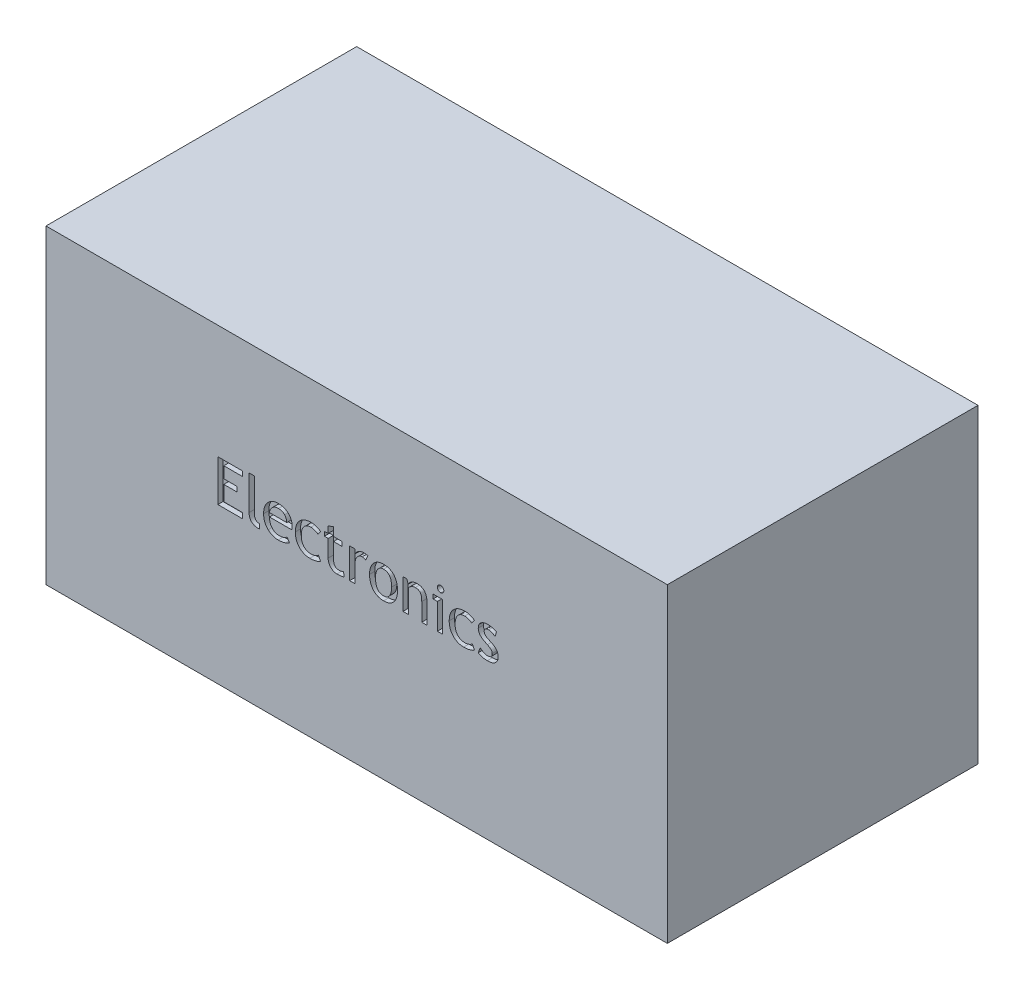
from build123d import *

# Parameters (mm, degrees)
SKETCH1_W           = 1524
SKETCH1_H           = 762
BOSS_EXTRUDE1_DEPTH = 762
CUT_EXTRUDE1_DEPTH  = 12.7


with BuildPart() as part:
    # Sketch1 → Boss-Extrude1 (new body)
    with BuildSketch(Plane(origin=(0, 0, 0), x_dir=(1, 0, 0), z_dir=(0, 1, 0))):
        Rectangle(SKETCH1_W, SKETCH1_H)
    extrude(amount=BOSS_EXTRUDE1_DEPTH)

    # Sketch2 → Cut-Extrude1 (cut)
    # profile 1 of 12: a face of its own
    with BuildSketch(Plane.XY.offset(381)):
        Polygon((-325.911688312, 470.724675325), (-325.911688312, 443.015584416), (-292.924675325, 443.015584416), (-292.924675325, 431.14025974), (-325.911688312, 431.14025974), (-325.911688312, 394.194805195), (-279.72987013, 394.194805195), (-279.72987013, 381), (-340.425974026, 381), (-340.425974026, 482.6), (-279.72987013, 482.6), (-279.72987013, 470.724675325), align=None)
    # profile 2 of 12: a face of its own
    with BuildSketch(Plane.XY.offset(381)):
        with BuildLine():
            Line((-263.896103896, 402.23538961), (-263.896103896, 486.558441558))
            Line((-263.896103896, 486.558441558), (-250.701298701, 486.558441558))
            Line((-250.701298701, 486.558441558), (-250.701298701, 404.48262987))
            add(Edge.make_bspline(
                [(-250.701298701, 404.48262987), (-250.666210351, 403.530308684), (-250.599014993, 401.706581956), (-249.967566383, 399.135515997), (-248.955585387, 396.860193421), (-247.496621835, 394.955404889), (-245.708733534, 393.429096108), (-243.63045224, 392.339333551), (-241.30849941, 391.653364424), (-239.669301946, 391.588972343), (-238.825974026, 391.555844156)],
                knots=[0, 0, 0, 0, 1.153096326, 2.208217795, 3.189003511, 4.152427551, 5.092536401, 6.017113196, 6.979852129, 8, 8, 8, 8], degree=3))
            Line((-238.825974026, 391.555844156), (-238.825974026, 379.680519481))
            add(Edge.make_bspline(
                [(-238.825974026, 379.680519481), (-239.83689173, 379.693374265), (-241.800683125, 379.718345748), (-244.644801944, 379.995557449), (-247.300732108, 380.417689091), (-249.76037151, 381.029109515), (-252.021542975, 381.839649736), (-254.090814403, 382.804079175), (-255.978076645, 383.942349325), (-257.640441598, 385.288709894), (-259.129480681, 386.789001581), (-260.418786424, 388.468387403), (-261.484866378, 390.341948311), (-262.385061446, 392.375548529), (-263.054526871, 394.600909337), (-263.549773334, 396.994088826), (-263.835173441, 399.562081704), (-263.875412223, 401.327547824), (-263.896103896, 402.23538961)],
                knots=[0, 0, 0, 0, 1.254804711, 2.437562112, 3.544378597, 4.591567393, 5.579398935, 6.522239218, 7.422250788, 8.308443737, 9.171282686, 10.041683172, 10.928615266, 11.841798046, 12.797257397, 13.808040261, 14.872845747, 16, 16, 16, 16], degree=3))
        make_face()
    # profile 3 of 12: a face of its own
    with BuildSketch(Plane.XY.offset(381)):
        with BuildLine():
            Line((-159.389123377, 417.945454545), (-213.755844156, 417.945454545))
            add(Edge.make_bspline(
                [(-213.755844156, 417.945454545), (-213.729563533, 416.82454726), (-213.678496864, 414.646478532), (-213.356702353, 411.479001529), (-212.781403168, 408.518712387), (-211.969844598, 405.762197663), (-210.968406357, 403.181343299), (-209.709015553, 400.809226442), (-208.217516989, 398.631626912), (-207.04362346, 397.350009988), (-206.457467532, 396.710064935)],
                knots=[0, 0, 0, 0, 1.167775368, 2.269139511, 3.312377417, 4.304673693, 5.259241788, 6.191231847, 7.096834467, 8, 8, 8, 8], degree=3))
            add(Edge.make_bspline(
                [(-206.457467532, 396.710064935), (-205.913177858, 396.186802308), (-204.835999826, 395.151237914), (-203.012904675, 393.864701835), (-201.113695138, 392.729141989), (-199.078637201, 391.8345228), (-196.947475311, 391.090879069), (-194.68743036, 390.61875108), (-192.323939021, 390.289633601), (-190.707381258, 390.254376325), (-189.881493506, 390.236363636)],
                knots=[0, 0, 0, 0, 0.989843858, 1.958953311, 2.921404456, 3.890597899, 4.872059572, 5.879024385, 6.91640879, 8, 8, 8, 8], degree=3))
            add(Edge.make_bspline(
                [(-189.881493506, 390.236363636), (-188.939088371, 390.255222554), (-187.090266595, 390.292220207), (-184.373767666, 390.61137564), (-181.772461164, 391.120404144), (-179.287705734, 391.843287129), (-176.925885963, 392.772695244), (-174.690192048, 393.912926904), (-172.567185904, 395.255972264), (-171.261837702, 396.305446655), (-170.604707792, 396.833766234)],
                knots=[0, 0, 0, 0, 1.086166282, 2.13085413, 3.148605832, 4.138974104, 5.110011886, 6.070258581, 7.028542114, 8, 8, 8, 8], degree=3))
            Line((-170.604707792, 396.833766234), (-164.935064935, 387.597402597))
            add(Edge.make_bspline(
                [(-164.935064935, 387.597402597), (-165.51299015, 387.104973695), (-166.744427714, 386.055710863), (-168.997029044, 384.776127521), (-171.612508389, 383.521573833), (-173.544601062, 382.855938078), (-174.563149351, 382.505032468)],
                knots=[0, 0, 0, 0, 0.829008863, 1.766444218, 2.822528312, 4, 4, 4, 4], degree=3))
            add(Edge.make_bspline(
                [(-174.563149351, 382.505032468), (-175.944259997, 382.066132269), (-178.755996571, 381.172596517), (-183.186227714, 380.312109864), (-187.8415324, 379.791444303), (-191.02085828, 379.718012321), (-192.644155844, 379.680519481)],
                knots=[0, 0, 0, 0, 0.945414737, 1.92472428, 2.940407449, 4, 4, 4, 4], degree=3))
            add(Edge.make_bspline(
                [(-192.644155844, 379.680519481), (-193.820788003, 379.706054434), (-196.141856013, 379.756425626), (-199.553176271, 380.221153041), (-202.82450223, 380.983974075), (-205.957101901, 382.044543486), (-208.962917263, 383.380972404), (-211.821815718, 385.05118356), (-214.557335946, 387.003717275), (-216.230423607, 388.52160728), (-217.075162338, 389.287987013)],
                knots=[0, 0, 0, 0, 1.048227686, 2.067772609, 3.061680434, 4.037860413, 5.011115386, 5.988102045, 6.984196606, 8, 8, 8, 8], degree=3))
            add(Edge.make_bspline(
                [(-217.075162338, 389.287987013), (-217.968430744, 390.190457343), (-219.745230977, 391.985561122), (-222.037332292, 394.995168977), (-223.968769226, 398.234786481), (-225.533992726, 401.704630616), (-226.787857013, 405.387321485), (-227.629459192, 409.311279577), (-228.193561191, 413.448299749), (-228.24421968, 416.28725252), (-228.27012987, 417.739285714)],
                knots=[0, 0, 0, 0, 0.967481273, 1.924417048, 2.876158889, 3.837660968, 4.822011602, 5.836599495, 6.893490101, 8, 8, 8, 8], degree=3))
            add(Edge.make_bspline(
                [(-228.27012987, 417.739285714), (-228.234291566, 419.245928951), (-228.164016842, 422.200280172), (-227.619943968, 426.513364676), (-226.736717392, 430.600184853), (-225.503452411, 434.461127487), (-223.884246308, 438.086374078), (-221.919419806, 441.481511191), (-219.598756976, 444.659039826), (-217.784802739, 446.553573596), (-216.868993506, 447.510064935)],
                knots=[0, 0, 0, 0, 1.103286409, 2.163415646, 3.178379871, 4.162134233, 5.126549343, 6.08055717, 7.030932849, 8, 8, 8, 8], degree=3))
            add(Edge.make_bspline(
                [(-216.868993506, 447.510064935), (-216.009949678, 448.309360318), (-214.320354861, 449.881439986), (-211.584240154, 451.935485589), (-208.715565456, 453.650878626), (-205.748527744, 455.087309942), (-202.648978224, 456.182101992), (-199.439536482, 456.973014767), (-196.106966599, 457.426046164), (-193.848127659, 457.495003638), (-192.706006494, 457.52987013)],
                knots=[0, 0, 0, 0, 1.047961233, 2.061163597, 3.050032296, 4.030553054, 5.001664552, 5.981646773, 6.979473968, 8, 8, 8, 8], degree=3))
            add(Edge.make_bspline(
                [(-192.706006494, 457.52987013), (-191.392375274, 457.501414491), (-188.827153046, 457.445847116), (-185.087514583, 457.035248135), (-181.563705957, 456.332419956), (-178.255789363, 455.367852662), (-175.159451507, 454.134813017), (-172.295552803, 452.592230041), (-169.63439462, 450.787309474), (-168.053340608, 449.357250813), (-167.264772727, 448.643993506)],
                knots=[0, 0, 0, 0, 1.140665541, 2.227459699, 3.262123076, 4.257359294, 5.215990926, 6.15052194, 7.077552707, 8, 8, 8, 8], degree=3))
            add(Edge.make_bspline(
                [(-167.264772727, 448.643993506), (-166.554160668, 447.916362412), (-165.143826231, 446.472250711), (-163.324954783, 444.053003131), (-161.765022596, 441.467649209), (-160.506517841, 438.6908205), (-159.540456735, 435.743324924), (-158.834225381, 432.631778583), (-158.422386116, 429.34390623), (-158.366297266, 427.093632774), (-158.337662338, 425.944805195)],
                knots=[0, 0, 0, 0, 0.971813225, 1.928734025, 2.886782605, 3.854408881, 4.837446585, 5.848277975, 6.901485685, 8, 8, 8, 8], degree=3))
            add(Edge.make_bspline(
                [(-158.337662338, 425.944805195), (-158.34701926, 425.236337988), (-158.365411662, 423.843741905), (-158.585147901, 421.799403196), (-158.902199674, 419.833512021), (-159.228370192, 418.568778592), (-159.389123377, 417.945454545)],
                knots=[0, 0, 0, 0, 1.050108016, 2.064141145, 3.045911693, 4, 4, 4, 4], degree=3))
        make_face()
        with BuildLine():
            add(Edge.make_bspline(
                [(-191.963798701, 446.974025974), (-192.707158465, 446.962795571), (-194.165491842, 446.940763612), (-196.295067788, 446.631638637), (-198.333877699, 446.186638661), (-200.281416896, 445.542661698), (-202.14636601, 444.714381385), (-203.922509249, 443.701636693), (-205.608051166, 442.505918751), (-206.625045602, 441.570075896), (-207.137824675, 441.098214286)],
                knots=[0, 0, 0, 0, 1.06759705, 2.094426531, 3.086601989, 4.06436251, 5.037270591, 6.015031111, 6.999158234, 8, 8, 8, 8], degree=3))
            add(Edge.make_bspline(
                [(-207.137824675, 441.098214286), (-207.608106508, 440.626007397), (-208.537723637, 439.692584965), (-209.750553205, 438.147736958), (-210.839094899, 436.538754274), (-211.737982189, 434.826149344), (-212.489732543, 433.03232381), (-213.082574591, 431.162959906), (-213.529560203, 429.204909909), (-213.679516005, 427.864230033), (-213.755844156, 427.181818182)],
                knots=[0, 0, 0, 0, 1.014452497, 2.005292046, 2.986739539, 3.97025095, 4.946323062, 5.946247264, 6.954630981, 8, 8, 8, 8], degree=3))
            Line((-213.755844156, 427.181818182), (-171.532467532, 427.181818182))
            add(Edge.make_bspline(
                [(-171.532467532, 427.181818182), (-171.547367821, 427.856148311), (-171.576664224, 429.181991607), (-171.834682558, 431.119086204), (-172.223832804, 432.97647376), (-172.774665877, 434.747834241), (-173.510377196, 436.435307019), (-174.389934322, 438.043769365), (-175.449481043, 439.557867847), (-176.258902734, 440.48667311), (-176.666071429, 440.953896104)],
                knots=[0, 0, 0, 0, 1.074154994, 2.111964356, 3.108624356, 4.095792429, 5.062147245, 6.037581814, 7.012831928, 8, 8, 8, 8], degree=3))
            add(Edge.make_bspline(
                [(-176.666071429, 440.953896104), (-177.14481781, 441.431113596), (-178.098930327, 442.382179127), (-179.693157144, 443.630918939), (-181.435788648, 444.652896996), (-183.289657728, 445.514731808), (-185.276947179, 446.166708908), (-187.394587317, 446.649052565), (-189.641563484, 446.905410304), (-191.179787333, 446.950860592), (-191.963798701, 446.974025974)],
                knots=[0, 0, 0, 0, 0.95760174, 1.908442216, 2.860628821, 3.81510446, 4.800779991, 5.819262726, 6.888508446, 8, 8, 8, 8], degree=3))
        make_face(mode=Mode.SUBTRACT)
    # profile 4 of 12: a face of its own
    with BuildSketch(Plane.XY.offset(381)):
        with BuildLine():
            Line((-88.405194805, 449.612987013), (-94.981980519, 440.376623377))
            add(Edge.make_bspline(
                [(-94.981980519, 440.376623377), (-95.375501944, 440.782199051), (-96.226844885, 441.659620119), (-97.875531575, 442.764443361), (-99.877315327, 443.863035014), (-102.197765035, 444.887103451), (-104.693983291, 445.817655886), (-107.253374875, 446.460903689), (-109.782726096, 446.912428962), (-111.466703646, 446.95363278), (-112.300162338, 446.974025974)],
                knots=[0, 0, 0, 0, 0.714129473, 1.544945328, 2.499524529, 3.606123095, 4.754426172, 5.869211769, 6.945399259, 8, 8, 8, 8], degree=3))
            add(Edge.make_bspline(
                [(-112.300162338, 446.974025974), (-113.181300023, 446.951764297), (-114.91043263, 446.908078284), (-117.429869394, 446.521229758), (-119.813786368, 445.938297392), (-122.056386484, 445.077014017), (-124.152170766, 443.966970642), (-126.106115822, 442.612171724), (-127.922353188, 441.026150136), (-129.581674348, 439.199166577), (-131.058393795, 437.150398962), (-132.373008869, 434.935689491), (-133.459506144, 432.524145276), (-134.372075609, 429.940080827), (-135.068514685, 427.164836455), (-135.557014993, 424.213666668), (-135.845944214, 421.084984953), (-135.885949765, 418.942555432), (-135.906493506, 417.84237013)],
                knots=[0, 0, 0, 0, 0.999237626, 1.960890323, 2.885732248, 3.779273414, 4.679256432, 5.570446663, 6.471273863, 7.409692175, 8.364268318, 9.332537753, 10.32704794, 11.360420259, 12.438461241, 13.569168563, 14.751713886, 16, 16, 16, 16], degree=3))
            add(Edge.make_bspline(
                [(-135.906493506, 417.84237013), (-135.88855508, 416.748805206), (-135.853729809, 414.625782054), (-135.532491533, 411.547414842), (-135.052858426, 408.669254341), (-134.349119887, 405.991454052), (-133.447068153, 403.509137919), (-132.33381036, 401.223508635), (-130.99892235, 399.152247383), (-129.502232129, 397.262590002), (-127.7920456, 395.610083203), (-125.942049563, 394.156481475), (-123.911799287, 392.953760005), (-121.734062387, 391.961136989), (-119.39958309, 391.176308391), (-116.91201092, 390.624937115), (-114.275039943, 390.286478577), (-112.466150829, 390.253366003), (-111.537337662, 390.236363636)],
                knots=[0, 0, 0, 0, 1.252959939, 2.432469166, 3.543482404, 4.594231037, 5.600926928, 6.566094148, 7.501227139, 8.420098036, 9.322413799, 10.220456753, 11.110624572, 12.019960222, 12.958966101, 13.927758104, 14.935962662, 16, 16, 16, 16], degree=3))
            add(Edge.make_bspline(
                [(-111.537337662, 390.236363636), (-110.794089415, 390.256380593), (-109.301261361, 390.296585026), (-107.065368441, 390.61954166), (-104.825184465, 391.140177404), (-102.581819249, 391.858964953), (-100.33917117, 392.801410233), (-98.090071221, 393.943508858), (-95.82061897, 395.271475774), (-94.362867792, 396.306976229), (-93.621266234, 396.833766234)],
                knots=[0, 0, 0, 0, 0.918512099, 1.844848789, 2.786639656, 3.75923298, 4.753223091, 5.790457131, 6.875939558, 8, 8, 8, 8], degree=3))
            Line((-93.621266234, 396.833766234), (-88.405194805, 386.277922078))
            add(Edge.make_bspline(
                [(-88.405194805, 386.277922078), (-89.317640446, 385.746535824), (-91.158032482, 384.674736053), (-94.103910872, 383.34542014), (-97.19860079, 382.211703783), (-100.450890881, 381.281916999), (-103.861420597, 380.562382871), (-107.435837128, 380.052682398), (-111.167408949, 379.737255807), (-113.708350743, 379.699650158), (-115.000974026, 379.680519481)],
                knots=[0, 0, 0, 0, 0.912713853, 1.840933016, 2.79052362, 3.761251731, 4.763775478, 5.802708547, 6.882197894, 8, 8, 8, 8], degree=3))
            add(Edge.make_bspline(
                [(-115.000974026, 379.680519481), (-116.253230335, 379.712785521), (-118.711947662, 379.776137626), (-122.317203346, 380.257585569), (-125.759201221, 381.057067261), (-129.030105576, 382.201338303), (-132.146251757, 383.645414335), (-135.082756725, 385.434097149), (-137.863075026, 387.528607117), (-140.455934069, 389.931838858), (-142.791090042, 392.625601601), (-144.861504308, 395.547589513), (-146.56503251, 398.721383221), (-147.975550953, 402.113218237), (-149.093167454, 405.727789859), (-149.867736976, 409.574962347), (-150.321946064, 413.646216993), (-150.387248319, 416.432372976), (-150.420779221, 417.862987013)],
                knots=[0, 0, 0, 0, 1.025697672, 2.013885354, 2.973956964, 3.915895403, 4.847870077, 5.782561884, 6.72732302, 7.69541756, 8.673156467, 9.643164676, 10.623186641, 11.617578138, 12.648716234, 13.717577208, 14.828039025, 16, 16, 16, 16], degree=3))
            add(Edge.make_bspline(
                [(-150.420779221, 417.862987013), (-150.390133664, 419.321280238), (-150.330103636, 422.177856998), (-149.831054662, 426.346008829), (-149.000154131, 430.289157614), (-147.877600907, 434.027411412), (-146.386187394, 437.532053468), (-144.58302534, 440.829627469), (-142.426365878, 443.881925995), (-139.971737845, 446.711023626), (-137.240584395, 449.270827428), (-134.233490103, 451.484354292), (-130.984322578, 453.361075033), (-127.492277314, 454.872809526), (-123.768981603, 456.090491842), (-119.79914144, 456.911016205), (-115.592979946, 457.448339786), (-112.707378426, 457.502238919), (-111.228084416, 457.52987013)],
                knots=[0, 0, 0, 0, 1.110701233, 2.175696407, 3.192233128, 4.177621257, 5.144178712, 6.088488417, 7.035508184, 7.985562121, 8.937561489, 9.881014532, 10.823915415, 11.789806225, 12.774916153, 13.802781966, 14.873603491, 16, 16, 16, 16], degree=3))
            add(Edge.make_bspline(
                [(-111.228084416, 457.52987013), (-110.230105068, 457.493925532), (-108.175665891, 457.419930021), (-105.037169861, 456.932704207), (-101.789727288, 456.086643196), (-98.526017402, 454.974947963), (-95.418224156, 453.712259137), (-92.65451816, 452.41006897), (-90.326209226, 451.085169378), (-89.014548683, 450.07996947), (-88.405194805, 449.612987013)],
                knots=[0, 0, 0, 0, 0.977055502, 2.011365371, 3.101418391, 4.258843969, 5.384546701, 6.383661135, 7.249102703, 8, 8, 8, 8], degree=3))
        make_face()
    # profile 5 of 12: a face of its own
    with BuildSketch(Plane.XY.offset(381)):
        with BuildLine():
            Line((-69.932467532, 444.335064935), (-79.168831169, 444.335064935))
            Line((-79.168831169, 444.335064935), (-79.168831169, 454.890909091))
            Line((-79.168831169, 454.890909091), (-69.932467532, 454.890909091))
            Line((-69.932467532, 454.890909091), (-69.932467532, 470.807142857))
            Line((-69.932467532, 470.807142857), (-56.737662338, 476.002597403))
            Line((-56.737662338, 476.002597403), (-56.737662338, 454.890909091))
            Line((-56.737662338, 454.890909091), (-35.625974026, 454.890909091))
            Line((-35.625974026, 454.890909091), (-35.625974026, 444.335064935))
            Line((-35.625974026, 444.335064935), (-56.737662338, 444.335064935))
            Line((-56.737662338, 444.335064935), (-56.737662338, 407.492694805))
            add(Edge.make_bspline(
                [(-56.737662338, 407.492694805), (-56.734318765, 406.743183194), (-56.727837265, 405.290258195), (-56.549198843, 403.19967183), (-56.31715607, 401.276195739), (-55.963445831, 399.525872036), (-55.516455873, 397.937381673), (-54.967489143, 396.509421522), (-54.303857638, 395.255409564), (-53.533175301, 394.167688736), (-52.65253178, 393.225468378), (-51.657029555, 392.402928587), (-50.505689434, 391.759962375), (-49.2630559, 391.189851131), (-47.890880358, 390.761668061), (-46.399213227, 390.455979347), (-44.784611849, 390.268725989), (-43.667079553, 390.247393235), (-43.089285714, 390.236363636)],
                knots=[0, 0, 0, 0, 1.412375387, 2.737883543, 3.952723546, 5.06303916, 6.100522586, 7.060446298, 7.941412932, 8.768226801, 9.565694039, 10.366940763, 11.191315048, 12.043716813, 12.941012141, 13.893828134, 14.911053281, 16, 16, 16, 16], degree=3))
            add(Edge.make_bspline(
                [(-43.089285714, 390.236363636), (-42.214118322, 390.268657108), (-40.436536128, 390.334249474), (-37.755653367, 390.865429156), (-35.025997627, 391.675870268), (-33.253947257, 392.469525197), (-32.34788961, 392.875324675)],
                knots=[0, 0, 0, 0, 0.941382402, 1.912073746, 2.932433537, 4, 4, 4, 4], degree=3))
            Line((-32.34788961, 392.875324675), (-30.348051948, 381.680357143))
            add(Edge.make_bspline(
                [(-30.348051948, 381.680357143), (-31.767490865, 381.374985539), (-34.653378936, 380.754128765), (-39.128874717, 380.121627454), (-43.804417376, 379.749759925), (-46.992051352, 379.703875447), (-48.61461039, 379.680519481)],
                knots=[0, 0, 0, 0, 0.94587189, 1.923070004, 2.942807876, 4, 4, 4, 4], degree=3))
            add(Edge.make_bspline(
                [(-48.61461039, 379.680519481), (-49.351269665, 379.698707417), (-50.796943972, 379.73440076), (-52.913860468, 380.063783808), (-54.953480722, 380.542136697), (-56.893422774, 381.281542309), (-58.763865041, 382.187486393), (-60.542765599, 383.304581365), (-62.221736124, 384.63955705), (-63.792751193, 386.153675139), (-65.238081432, 387.816748017), (-66.491922743, 389.608192422), (-67.559088094, 391.506165466), (-68.420564085, 393.512455255), (-69.109959021, 395.621802983), (-69.576236004, 397.848205789), (-69.870824776, 400.172683972), (-69.911728517, 401.760304407), (-69.932467532, 402.56525974)],
                knots=[0, 0, 0, 0, 1.011657449, 1.985350936, 2.938256691, 3.885576537, 4.83171868, 5.790782512, 6.765757656, 7.774368669, 8.785452854, 9.788965921, 10.774179575, 11.772479321, 12.784974034, 13.818611436, 14.893992343, 16, 16, 16, 16], degree=3))
            Line((-69.932467532, 402.56525974), (-69.932467532, 444.335064935))
        make_face()
    # profile 6 of 12: a face of its own
    with BuildSketch(Plane.XY.offset(381)):
        with BuildLine():
            add(Edge.make_bspline(
                [(22.225, 443.984577922), (21.514116545, 444.436825565), (20.137724199, 445.3124546), (17.956438236, 446.272302654), (15.755123126, 446.864537515), (14.277236523, 446.937761003), (13.545292208, 446.974025974)],
                knots=[0, 0, 0, 0, 1.083912525, 2.09864063, 3.058324786, 4, 4, 4, 4], degree=3))
            add(Edge.make_bspline(
                [(13.545292208, 446.974025974), (12.966614768, 446.954702119), (11.821442196, 446.916461213), (10.137618745, 446.595839065), (8.511439485, 446.074458614), (6.939926953, 445.348094121), (5.417555712, 444.414795684), (3.982358769, 443.239099042), (2.568220726, 441.900797622), (1.250504938, 440.357628343), (0.00830969, 438.693052931), (-1.023746521, 436.884259357), (-1.960201608, 435.026728353), (-2.659264674, 433.058948912), (-3.254833846, 431.025433519), (-3.657438439, 428.898920512), (-3.913306874, 426.68642947), (-3.943241512, 425.18270756), (-3.958441558, 424.419155844)],
                knots=[0, 0, 0, 0, 0.879821936, 1.741121875, 2.597521335, 3.47235911, 4.368980926, 5.306256831, 6.289802627, 7.327487782, 8.389847235, 9.44425347, 10.491690238, 11.550235473, 12.6158827, 13.712920077, 14.838679022, 16, 16, 16, 16], degree=3))
            Line((-3.958441558, 424.419155844), (-3.958441558, 381))
            Line((-3.958441558, 381), (-17.153246753, 381))
            Line((-17.153246753, 381), (-17.153246753, 454.890909091))
            Line((-17.153246753, 454.890909091), (-3.958441558, 454.890909091))
            Line((-3.958441558, 454.890909091), (-3.958441558, 444.335064935))
            add(Edge.make_bspline(
                [(-3.958441558, 444.335064935), (-3.343630933, 445.381923602), (-2.151048013, 447.412574527), (-0.005179058, 450.118459497), (2.358825591, 452.41612363), (4.961990225, 454.295158581), (7.79247367, 455.749881333), (10.840898734, 456.785980772), (14.103356956, 457.418514239), (16.353176651, 457.492191567), (17.503733766, 457.52987013)],
                knots=[0, 0, 0, 0, 1.095181229, 2.124384928, 3.107413611, 4.063213658, 5.012363421, 5.969994755, 6.961855929, 8, 8, 8, 8], degree=3))
            add(Edge.make_bspline(
                [(17.503733766, 457.52987013), (18.156840317, 457.507485588), (19.602830428, 457.457925795), (21.96588738, 457.253763728), (24.710274945, 456.835075703), (26.664995086, 456.508518462), (27.709090909, 456.334090909)],
                knots=[0, 0, 0, 0, 0.762334318, 1.687822431, 2.764971572, 4, 4, 4, 4], degree=3))
            Line((27.709090909, 456.334090909), (22.225, 443.984577922))
        make_face()
    # profile 7 of 12: a face of its own
    with BuildSketch(Plane.XY.offset(381)):
        with BuildLine():
            add(Edge.make_bspline(
                [(31.667532468, 418.77012987), (31.690727939, 420.187391981), (31.736006841, 422.95396952), (32.221304031, 426.995537275), (32.90529859, 430.84202268), (33.983127513, 434.46075076), (35.28993536, 437.888998562), (36.925130748, 441.093227543), (38.862039809, 444.083766746), (41.057256841, 446.858523179), (43.49509486, 449.378189017), (46.173136684, 451.543666792), (49.01792383, 453.40678357), (52.061449422, 454.90706786), (55.287029345, 456.096286621), (58.695223132, 456.93560554), (62.295923532, 457.440563705), (64.755961081, 457.499632621), (66.01525974, 457.52987013)],
                knots=[0, 0, 0, 0, 1.167075045, 2.278197929, 3.349840171, 4.38193595, 5.384007613, 6.36905809, 7.339665984, 8.31503514, 9.280011473, 10.221801653, 11.146830462, 12.076146957, 13.011241213, 13.973905745, 14.962837872, 16, 16, 16, 16], degree=3))
            add(Edge.make_bspline(
                [(66.01525974, 457.52987013), (67.336079687, 457.497798045), (69.910972071, 457.435274636), (73.662299231, 456.960891109), (77.18117407, 456.151916807), (80.488716375, 455.058412233), (83.530900618, 453.560096875), (86.384382837, 451.82164842), (88.978107273, 449.703314558), (91.352992928, 447.298185044), (93.444456339, 444.583528082), (95.304280847, 441.639737038), (96.841633626, 438.431113641), (98.103941061, 434.977533183), (99.091557534, 431.279644283), (99.784242954, 427.327070803), (100.197694253, 423.129127907), (100.252426514, 420.24863092), (100.280519481, 418.77012987)],
                knots=[0, 0, 0, 0, 1.079863132, 2.105155485, 3.085271676, 4.028881107, 4.946240321, 5.852238611, 6.755304408, 7.677196192, 8.610170789, 9.551904321, 10.519520607, 11.513330615, 12.554742623, 13.644922898, 14.791186388, 16, 16, 16, 16], degree=3))
            add(Edge.make_bspline(
                [(100.280519481, 418.77012987), (100.254156128, 417.298352799), (100.202664531, 414.423750567), (99.762892619, 410.232930163), (99.050317815, 406.28050725), (98.040211278, 402.566773908), (96.738367725, 399.097432656), (95.177615109, 395.849956624), (93.280602906, 392.867059233), (91.124759044, 390.124888031), (88.714484714, 387.674707315), (86.092052895, 385.52580029), (83.262799692, 383.697839766), (80.19935423, 382.238450051), (76.951267379, 381.065190314), (73.480520319, 380.282971805), (69.817375362, 379.76718273), (67.302231023, 379.709853968), (66.01525974, 379.680519481)],
                knots=[0, 0, 0, 0, 1.20188332, 2.347459098, 3.437446682, 4.479189465, 5.486346161, 6.460407083, 7.416593509, 8.367774511, 9.304535764, 10.218052079, 11.132051152, 12.048408626, 12.984076073, 13.946715913, 14.949357453, 16, 16, 16, 16], degree=3))
            add(Edge.make_bspline(
                [(66.01525974, 379.680519481), (64.701064833, 379.710859119), (62.131681128, 379.770176174), (58.395044891, 380.270880019), (54.877620057, 381.0943029), (51.584686234, 382.24971518), (48.502291623, 383.734833084), (45.670098261, 385.596564217), (43.028804914, 387.738167395), (40.660206624, 390.23311183), (38.538170064, 392.990246542), (36.701413042, 396.003559939), (35.120053782, 399.226183081), (33.868517518, 402.702286789), (32.887942613, 406.394130876), (32.155586085, 410.313344181), (31.753235056, 414.466446149), (31.696561794, 417.312378821), (31.667532468, 418.77012987)],
                knots=[0, 0, 0, 0, 1.070809026, 2.093539738, 3.066333794, 4.010584142, 4.932489864, 5.847597811, 6.767066902, 7.698065835, 8.644771889, 9.597770613, 10.56977414, 11.565661655, 12.603739209, 13.680407079, 14.811852069, 16, 16, 16, 16], degree=3))
        make_face()
        with BuildLine():
            add(Edge.make_bspline(
                [(46.181818182, 418.790746753), (46.198748329, 417.635885363), (46.231534395, 415.399439311), (46.451694962, 412.156350204), (46.845986967, 409.142439487), (47.367170728, 406.347858995), (48.075835121, 403.780137763), (48.908554665, 401.42016382), (49.916604989, 399.279775404), (51.101155484, 397.383383789), (52.397754625, 395.674030359), (53.904115321, 394.234933745), (55.529081362, 392.977883018), (57.336764745, 391.985702307), (59.285331088, 391.190972914), (61.402033589, 390.652062894), (63.658687409, 390.279336942), (65.216457577, 390.250930204), (66.01525974, 390.236363636)],
                knots=[0, 0, 0, 0, 1.403165019, 2.717298277, 3.94664954, 5.094588496, 6.168180087, 7.179748012, 8.132138505, 9.035809774, 9.892631734, 10.731111953, 11.559427893, 12.381788447, 13.228378108, 14.109391495, 15.030523118, 16, 16, 16, 16], degree=3))
            add(Edge.make_bspline(
                [(66.01525974, 390.236363636), (66.765707552, 390.260814397), (68.233801626, 390.308647192), (70.374731635, 390.663194397), (72.393689989, 391.259695071), (74.279327339, 392.117933919), (76.052434765, 393.187625645), (77.665569159, 394.537464028), (79.185312419, 396.088155692), (80.556797966, 397.888257897), (81.792944747, 399.890344251), (82.867295542, 402.077853758), (83.742554094, 404.447132186), (84.493604754, 406.971937357), (85.064729265, 409.682058041), (85.470154143, 412.56817527), (85.721956765, 415.625019694), (85.751232336, 417.718171077), (85.766233766, 418.790746753)],
                knots=[0, 0, 0, 0, 0.923804163, 1.807229492, 2.663987905, 3.50862415, 4.351860268, 5.205688153, 6.09138034, 7.020633582, 7.985836002, 8.98497942, 10.016045611, 11.092475389, 12.226097157, 13.422869221, 14.679422898, 16, 16, 16, 16], degree=3))
            add(Edge.make_bspline(
                [(85.766233766, 418.790746753), (85.749672768, 419.9319029), (85.717713278, 422.134111215), (85.49335379, 425.335561033), (85.105153477, 428.309193752), (84.57709707, 431.074906021), (83.877386698, 433.610908418), (83.036830955, 435.931465735), (82.044890998, 438.035328424), (80.894861566, 439.925618623), (79.559927191, 441.583286108), (78.094106446, 443.048338996), (76.451005987, 444.268321899), (74.663578878, 445.268184532), (72.719520698, 446.032348355), (70.625067142, 446.589971754), (68.369395701, 446.922883576), (66.81358488, 446.956682769), (66.01525974, 446.974025974)],
                knots=[0, 0, 0, 0, 1.39983981, 2.701417224, 3.934263667, 5.076720164, 6.152536382, 7.15800922, 8.100736454, 9.001519505, 9.865205975, 10.705747633, 11.536979174, 12.367269681, 13.211060351, 14.092422279, 15.021174534, 16, 16, 16, 16], degree=3))
            add(Edge.make_bspline(
                [(66.01525974, 446.974025974), (65.278382311, 446.950193157), (63.837270054, 446.903583282), (61.734701646, 446.539806357), (59.735460204, 445.968935694), (57.854595568, 445.134980929), (56.079951635, 444.079511904), (54.447094024, 442.758142811), (52.914252719, 441.228482428), (51.51483576, 439.469387284), (50.257779964, 437.507715685), (49.163348984, 435.351604402), (48.242646875, 433.016136356), (47.472981399, 430.51601281), (46.90892192, 427.829180489), (46.470348884, 424.974274813), (46.228123796, 421.935585935), (46.197508484, 419.856351389), (46.181818182, 418.790746753)],
                knots=[0, 0, 0, 0, 0.914220699, 1.787942746, 2.641014476, 3.488995239, 4.334612677, 5.196595123, 6.089350075, 7.017945201, 7.981047695, 8.976805699, 10.014401863, 11.093798887, 12.219885884, 13.419111779, 14.677298596, 16, 16, 16, 16], degree=3))
        make_face(mode=Mode.SUBTRACT)
    # profile 8 of 12: a face of its own
    with BuildSketch(Plane.XY.offset(381)):
        with BuildLine():
            Line((159.657142857, 381), (159.657142857, 425.140746753))
            add(Edge.make_bspline(
                [(159.657142857, 425.140746753), (159.6437869, 426.109899996), (159.618001912, 427.980945535), (159.463951831, 430.672811451), (159.168387623, 433.141831246), (158.796482137, 435.385330787), (158.276498513, 437.396337984), (157.664379025, 439.189321377), (156.932141139, 440.757376738), (156.071927954, 442.108958437), (155.083316636, 443.272112567), (153.935216029, 444.269754161), (152.635355527, 445.111402501), (151.180454958, 445.804361675), (149.579738512, 446.331773831), (147.822833894, 446.698477843), (145.918549464, 446.927037772), (144.593757472, 446.957966092), (143.905844156, 446.974025974)],
                knots=[0, 0, 0, 0, 1.492446799, 2.881315153, 4.149297822, 5.320165061, 6.380195938, 7.344060113, 8.233983445, 9.038310452, 9.803904108, 10.576414495, 11.371851317, 12.181244235, 13.051315478, 13.960411272, 14.940920345, 16, 16, 16, 16], degree=3))
            add(Edge.make_bspline(
                [(143.905844156, 446.974025974), (143.133482379, 446.942102789), (141.551609966, 446.876720987), (139.166323844, 446.329040457), (136.734471629, 445.448794907), (134.314689358, 444.247396372), (132.005656465, 442.814499033), (129.915147222, 441.20203058), (128.121599319, 439.407605229), (127.148664839, 438.067110571), (126.67012987, 437.407792208)],
                knots=[0, 0, 0, 0, 0.907481462, 1.858610735, 2.863275252, 3.943988719, 5.029406207, 6.054377481, 7.043051274, 8, 8, 8, 8], degree=3))
            Line((126.67012987, 437.407792208), (126.67012987, 381))
            Line((126.67012987, 381), (113.475324675, 381))
            Line((113.475324675, 381), (113.475324675, 454.890909091))
            Line((113.475324675, 454.890909091), (122.56737013, 454.890909091))
            Line((122.56737013, 454.890909091), (126.773214286, 445.283441558))
            add(Edge.make_bspline(
                [(126.773214286, 445.283441558), (127.339730695, 446.254785981), (128.445918927, 448.151447316), (130.487198866, 450.672892136), (132.803384456, 452.799869188), (135.376680841, 454.561424845), (138.246285374, 455.870507562), (141.343827517, 456.853055889), (144.708782941, 457.434958479), (147.037321345, 457.497626489), (148.23538961, 457.52987013)],
                knots=[0, 0, 0, 0, 1.033071533, 2.017190594, 2.969961518, 3.91657034, 4.872271586, 5.859733693, 6.898800578, 8, 8, 8, 8], degree=3))
            add(Edge.make_bspline(
                [(148.23538961, 457.52987013), (149.233066043, 457.506547962), (151.1661489, 457.461359281), (153.966950608, 457.101094022), (156.578191528, 456.542389453), (158.991971974, 455.70019591), (161.232818647, 454.661281391), (163.268004396, 453.351564771), (165.095254667, 451.799788216), (166.767882702, 450.053413311), (168.180243571, 448.01540156), (169.451281411, 445.788731256), (170.4991935, 443.307391245), (171.357334706, 440.600388685), (172.042738329, 437.658079779), (172.498850352, 434.478015819), (172.793584628, 431.070199663), (172.83209985, 428.721864973), (172.851948052, 427.511688312)],
                knots=[0, 0, 0, 0, 1.078049181, 2.088811887, 3.047630769, 3.959124913, 4.846352359, 5.711792439, 6.565904407, 7.433000711, 8.317268906, 9.238668105, 10.200417668, 11.222337962, 12.305289945, 13.461961816, 14.692062682, 16, 16, 16, 16], degree=3))
            Line((172.851948052, 427.511688312), (172.851948052, 381))
            Line((172.851948052, 381), (159.657142857, 381))
        make_face()
    # profile 9 of 12: a face of its own
    with BuildSketch(Plane.XY.offset(381)):
        with BuildLine():
            add(Edge.make_bspline(
                [(205.797727273, 482.6), (206.32957288, 482.572601865), (207.377322473, 482.518626832), (208.889778112, 482.079604783), (210.249403289, 481.308698573), (211.461795194, 480.30574867), (212.458619767, 479.096924203), (213.231062573, 477.761323726), (213.677094369, 476.277638117), (213.729217496, 475.249543904), (213.755844156, 474.724350649)],
                knots=[0, 0, 0, 0, 1.026037921, 2.021321229, 3.007360769, 4.025126835, 5.042892902, 6.017344784, 6.987177311, 8, 8, 8, 8], degree=3))
            add(Edge.make_bspline(
                [(213.755844156, 474.724350649), (213.728366064, 474.192563342), (213.674233512, 473.1449286), (213.236362183, 471.631633934), (212.458456115, 470.270548705), (211.467852654, 469.042526418), (210.25460949, 468.033471229), (208.883694727, 467.291151438), (207.378074538, 466.846185691), (206.329826098, 466.793153372), (205.797727273, 466.766233766)],
                knots=[0, 0, 0, 0, 1.019141304, 2.007734713, 2.987146489, 4.008246453, 5.019171502, 5.992265287, 6.980858696, 8, 8, 8, 8], degree=3))
            add(Edge.make_bspline(
                [(205.797727273, 466.766233766), (205.272108284, 466.792077692), (204.243180672, 466.842668575), (202.762939982, 467.300644063), (201.402017591, 468.032359067), (200.191210661, 469.043693996), (199.19466588, 470.264489239), (198.446249306, 471.637928112), (198.002224426, 473.144122039), (197.949063042, 474.192291775), (197.922077922, 474.724350649)],
                knots=[0, 0, 0, 0, 1.011670657, 1.980400051, 2.958964513, 3.975572925, 5.002413455, 5.980977917, 6.975129142, 8, 8, 8, 8], degree=3))
            add(Edge.make_bspline(
                [(197.922077922, 474.724350649), (197.947954395, 475.256819979), (197.998610603, 476.299190653), (198.451457045, 477.784501325), (199.169798417, 479.150727035), (200.179690843, 480.342387079), (201.371350887, 481.352279505), (202.737576597, 482.070620877), (204.222887269, 482.523467319), (205.265257943, 482.574123527), (205.797727273, 482.6)],
                knots=[0, 0, 0, 0, 1.029106498, 2.014595724, 2.979190096, 4, 5.020809904, 5.985404276, 6.970893502, 8, 8, 8, 8], degree=3))
        make_face()
    # profile 10 of 12: a face of its own
    with BuildSketch(Plane.XY.offset(381)):
        Polygon((197.922077922, 381), (197.922077922, 444.335064935), (187.366233766, 444.335064935), (187.366233766, 454.890909091), (211.116883117, 454.890909091), (211.116883117, 381), align=None)
    # profile 11 of 12: a face of its own
    with BuildSketch(Plane.XY.offset(381)):
        with BuildLine():
            Line((288.966233766, 449.612987013), (282.389448052, 440.376623377))
            add(Edge.make_bspline(
                [(282.389448052, 440.376623377), (281.995926628, 440.782199051), (281.144583686, 441.659620119), (279.495896997, 442.764443361), (277.494113245, 443.863035014), (275.173663536, 444.887103451), (272.67744528, 445.817655886), (270.118053696, 446.460903689), (267.588702475, 446.912428962), (265.904724925, 446.95363278), (265.071266234, 446.974025974)],
                knots=[0, 0, 0, 0, 0.714129473, 1.544945328, 2.499524529, 3.606123095, 4.754426172, 5.869211769, 6.945399259, 8, 8, 8, 8], degree=3))
            add(Edge.make_bspline(
                [(265.071266234, 446.974025974), (264.190128548, 446.951764297), (262.460995941, 446.908078284), (259.941559177, 446.521229758), (257.557642204, 445.938297392), (255.315042088, 445.077014017), (253.219257805, 443.966970642), (251.265312749, 442.612171724), (249.449075384, 441.026150136), (247.789754224, 439.199166577), (246.313034776, 437.150398962), (244.998419703, 434.935689491), (243.911922427, 432.524145276), (242.999352963, 429.940080827), (242.302913887, 427.164836455), (241.814413579, 424.213666668), (241.525484357, 421.084984953), (241.485478807, 418.942555432), (241.464935065, 417.84237013)],
                knots=[0, 0, 0, 0, 0.999237626, 1.960890323, 2.885732248, 3.779273414, 4.679256432, 5.570446663, 6.471273863, 7.409692175, 8.364268318, 9.332537753, 10.32704794, 11.360420259, 12.438461241, 13.569168563, 14.751713886, 16, 16, 16, 16], degree=3))
            add(Edge.make_bspline(
                [(241.464935065, 417.84237013), (241.482873492, 416.748805206), (241.517698763, 414.625782054), (241.838937039, 411.547414842), (242.318570146, 408.669254341), (243.022308684, 405.991454052), (243.924360418, 403.509137919), (245.037618212, 401.223508635), (246.372506221, 399.152247383), (247.869196443, 397.262590002), (249.579382971, 395.610083203), (251.429379008, 394.156481475), (253.459629284, 392.953760005), (255.637366184, 391.961136989), (257.971845481, 391.176308391), (260.459417652, 390.624937115), (263.096388628, 390.286478577), (264.905277742, 390.253366003), (265.834090909, 390.236363636)],
                knots=[0, 0, 0, 0, 1.252959939, 2.432469166, 3.543482404, 4.594231037, 5.600926928, 6.566094148, 7.501227139, 8.420098036, 9.322413799, 10.220456753, 11.110624572, 12.019960222, 12.958966101, 13.927758104, 14.935962662, 16, 16, 16, 16], degree=3))
            add(Edge.make_bspline(
                [(265.834090909, 390.236363636), (266.577339157, 390.256380593), (268.07016721, 390.296585026), (270.306060131, 390.61954166), (272.546244106, 391.140177404), (274.789609322, 391.858964953), (277.032257402, 392.801410233), (279.28135735, 393.943508858), (281.550809601, 395.271475774), (283.00856078, 396.306976229), (283.750162338, 396.833766234)],
                knots=[0, 0, 0, 0, 0.918512099, 1.844848789, 2.786639656, 3.75923298, 4.753223091, 5.790457131, 6.875939558, 8, 8, 8, 8], degree=3))
            Line((283.750162338, 396.833766234), (288.966233766, 386.277922078))
            add(Edge.make_bspline(
                [(288.966233766, 386.277922078), (288.053788125, 385.746535824), (286.213396089, 384.674736053), (283.267517699, 383.34542014), (280.172827781, 382.211703783), (276.92053769, 381.281916999), (273.510007975, 380.562382871), (269.935591444, 380.052682398), (266.204019623, 379.737255807), (263.663077828, 379.699650158), (262.370454545, 379.680519481)],
                knots=[0, 0, 0, 0, 0.912713853, 1.840933016, 2.79052362, 3.761251731, 4.763775478, 5.802708547, 6.882197894, 8, 8, 8, 8], degree=3))
            add(Edge.make_bspline(
                [(262.370454545, 379.680519481), (261.118198237, 379.712785521), (258.659480909, 379.776137626), (255.054225226, 380.257585569), (251.612227351, 381.057067261), (248.341322995, 382.201338303), (245.225176814, 383.645414335), (242.288671846, 385.434097149), (239.508353546, 387.528607117), (236.915494503, 389.931838858), (234.58033853, 392.625601601), (232.509924264, 395.547589513), (230.806396062, 398.721383221), (229.395877618, 402.113218237), (228.278261117, 405.727789859), (227.503691595, 409.574962347), (227.049482507, 413.646216993), (226.984180252, 416.432372976), (226.950649351, 417.862987013)],
                knots=[0, 0, 0, 0, 1.025697672, 2.013885354, 2.973956964, 3.915895403, 4.847870077, 5.782561884, 6.72732302, 7.69541756, 8.673156467, 9.643164676, 10.623186641, 11.617578138, 12.648716234, 13.717577208, 14.828039025, 16, 16, 16, 16], degree=3))
            add(Edge.make_bspline(
                [(226.950649351, 417.862987013), (226.981294907, 419.321280238), (227.041324935, 422.177856998), (227.54037391, 426.346008829), (228.371274441, 430.289157614), (229.493827665, 434.027411412), (230.985241178, 437.532053468), (232.788403231, 440.829627469), (234.945062693, 443.881925995), (237.399690726, 446.711023626), (240.130844176, 449.270827428), (243.137938469, 451.484354292), (246.387105993, 453.361075033), (249.879151258, 454.872809526), (253.602446968, 456.090491842), (257.572287132, 456.911016205), (261.778448625, 457.448339786), (264.664050145, 457.502238919), (266.143344156, 457.52987013)],
                knots=[0, 0, 0, 0, 1.110701233, 2.175696407, 3.192233128, 4.177621257, 5.144178712, 6.088488417, 7.035508184, 7.985562121, 8.937561489, 9.881014532, 10.823915415, 11.789806225, 12.774916153, 13.802781966, 14.873603491, 16, 16, 16, 16], degree=3))
            add(Edge.make_bspline(
                [(266.143344156, 457.52987013), (267.141323503, 457.493925532), (269.19576268, 457.419930021), (272.33425871, 456.932704207), (275.581701283, 456.086643196), (278.845411169, 454.974947963), (281.953204415, 453.712259137), (284.716910412, 452.41006897), (287.045219345, 451.085169378), (288.356879888, 450.07996947), (288.966233766, 449.612987013)],
                knots=[0, 0, 0, 0, 0.977055502, 2.011365371, 3.101418391, 4.258843969, 5.384546701, 6.383661135, 7.249102703, 8, 8, 8, 8], degree=3))
        make_face()
    # profile 12 of 12: a face of its own
    with BuildSketch(Plane.XY.offset(381)):
        with BuildLine():
            Line((298.202597403, 385.556331169), (302.800162338, 398.153246753))
            add(Edge.make_bspline(
                [(302.800162338, 398.153246753), (303.688365183, 397.527062467), (305.39473737, 396.324067615), (307.933629623, 394.714883221), (310.328550554, 393.340073072), (312.598504561, 392.218557615), (314.740709881, 391.344840458), (316.746039355, 390.719435344), (318.61783396, 390.316203285), (319.827944382, 390.262202795), (320.406980519, 390.236363636)],
                knots=[0, 0, 0, 0, 1.332253382, 2.559460521, 3.683996021, 4.716505285, 5.661560423, 6.517070436, 7.290420287, 8, 8, 8, 8], degree=3))
            add(Edge.make_bspline(
                [(320.406980519, 390.236363636), (321.35804156, 390.263041999), (323.144331124, 390.313149489), (325.637736891, 390.80903609), (327.775402325, 391.613094326), (329.511591828, 392.820932304), (330.888888452, 394.351050613), (331.831688282, 396.238555644), (332.428365936, 398.440412186), (332.481135736, 400.018209322), (332.509090909, 400.854058442)],
                knots=[0, 0, 0, 0, 1.237415283, 2.324122124, 3.296572087, 4.190537608, 5.052884192, 5.949713559, 6.91384635, 8, 8, 8, 8], degree=3))
            add(Edge.make_bspline(
                [(332.509090909, 400.854058442), (332.474166981, 401.483750987), (332.404453031, 402.74072172), (331.808421547, 404.575411174), (330.860272376, 406.329335575), (329.539484903, 408.011469633), (327.839015291, 409.594833282), (325.795585294, 411.13091953), (323.372090016, 412.589554588), (321.589785141, 413.451941416), (320.654383117, 413.904545455)],
                knots=[0, 0, 0, 0, 0.810114072, 1.617122017, 2.46134648, 3.37043313, 4.360517749, 5.448424735, 6.660863975, 8, 8, 8, 8], degree=3))
            add(Edge.make_bspline(
                [(320.654383117, 413.904545455), (319.923928034, 414.237106816), (318.519255823, 414.876625541), (316.528133195, 415.86443271), (314.687409782, 416.725438005), (313.066386793, 417.58630921), (311.615390159, 418.34147626), (310.357328811, 419.042662563), (309.28204628, 419.677878943), (307.583460906, 420.784222606), (305.357178331, 422.537677953), (303.196331307, 424.736958297), (301.748152196, 426.638059502), (300.774025074, 428.082729609), (300.010911122, 429.598944143), (299.322773336, 431.127500755), (298.840480284, 432.738812577), (298.461248431, 434.389650418), (298.258568294, 436.110893607), (298.221509586, 437.269891728), (298.202597403, 437.861363636)],
                knots=[0, 0, 0, 0, 1.23709491, 2.378945513, 3.426052076, 4.368942052, 5.207711754, 5.94752138, 6.588849952, 7.132436911, 9.071528894, 10.94447031, 11.866174453, 12.753511042, 13.625345716, 14.47942911, 15.333840934, 16.212854489, 17.08796542, 18, 18, 18, 18], degree=3))
            add(Edge.make_bspline(
                [(298.202597403, 437.861363636), (298.222514833, 438.611301859), (298.261612527, 440.083422241), (298.564299853, 442.231180359), (299.116130974, 444.242238779), (299.821136509, 446.139327048), (300.796392921, 447.884909073), (301.943685302, 449.522105344), (303.325283766, 451.014861848), (304.894099449, 452.377636301), (306.639176093, 453.577335637), (308.515644588, 454.638629205), (310.515897018, 455.558226606), (312.667785532, 456.256109785), (314.927145563, 456.85732299), (317.325915712, 457.223815028), (319.844455184, 457.487578775), (321.567642659, 457.515569259), (322.448051948, 457.52987013)],
                knots=[0, 0, 0, 0, 1.022782438, 2.007710539, 2.949032681, 3.862933841, 4.760636158, 5.668315145, 6.583849215, 7.527362271, 8.497233202, 9.466877628, 10.465273033, 11.4938377, 12.548717365, 13.650528614, 14.799610336, 16, 16, 16, 16], degree=3))
            add(Edge.make_bspline(
                [(322.448051948, 457.52987013), (323.149413045, 457.510542328), (324.603496168, 457.470471342), (326.858585108, 457.244337585), (329.238766495, 456.807200114), (331.765798514, 456.291109703), (334.398766446, 455.54748142), (337.17250574, 454.683436097), (340.081248971, 453.650491413), (342.050469272, 452.863529227), (343.064935065, 452.458116883)],
                knots=[0, 0, 0, 0, 0.788423695, 1.634583945, 2.543753211, 3.507206369, 4.532133891, 5.616758026, 6.772246325, 8, 8, 8, 8], degree=3))
            Line((343.064935065, 452.458116883), (339.353896104, 440.376623377))
            add(Edge.make_bspline(
                [(339.353896104, 440.376623377), (338.714987504, 440.901177832), (337.468884466, 441.924248897), (335.520831953, 443.273160679), (333.565641986, 444.402398494), (331.614070221, 445.349080451), (329.657861481, 446.06730381), (327.699667249, 446.592571912), (325.73677057, 446.913251166), (324.42154943, 446.953841642), (323.767532468, 446.974025974)],
                knots=[0, 0, 0, 0, 1.147535307, 2.238109229, 3.285624631, 4.280117791, 5.246232794, 6.174419652, 7.092197899, 8, 8, 8, 8], degree=3))
            add(Edge.make_bspline(
                [(323.767532468, 446.974025974), (323.016025066, 446.949126789), (321.568203184, 446.901157087), (319.489102942, 446.45282705), (317.588852025, 445.735147807), (315.915844127, 444.727633186), (314.490787869, 443.538765414), (313.473867199, 442.118379465), (312.832990669, 440.544644853), (312.755926145, 439.434182146), (312.716883117, 438.871590909)],
                knots=[0, 0, 0, 0, 1.185623905, 2.284172091, 3.342513114, 4.379428126, 5.356672626, 6.251331621, 7.114076051, 8, 8, 8, 8], degree=3))
            add(Edge.make_bspline(
                [(312.716883117, 438.871590909), (312.737821483, 438.271366578), (312.778969699, 437.091801713), (313.187588732, 435.387309098), (313.829035658, 433.799024712), (314.734213299, 432.328126288), (315.90825972, 430.984932591), (317.320569002, 429.742846842), (318.992911543, 428.617641585), (320.234104773, 427.999089528), (320.881168831, 427.676623377)],
                knots=[0, 0, 0, 0, 0.977472815, 1.920936105, 2.840937217, 3.761757322, 4.723421608, 5.73989644, 6.821753339, 8, 8, 8, 8], degree=3))
            Line((320.881168831, 427.676623377), (330.364935065, 423.223376623))
            add(Edge.make_bspline(
                [(330.364935065, 423.223376623), (331.734465929, 422.565198098), (334.342060518, 421.312022424), (337.820497877, 419.07231076), (340.732455445, 416.719234406), (343.093173465, 414.195897579), (344.87290521, 411.390085222), (346.144062275, 408.29625529), (346.892501601, 404.868437159), (346.978799364, 402.479690464), (347.023376623, 401.245779221)],
                knots=[0, 0, 0, 0, 1.237288181, 2.355803767, 3.362588053, 4.282183816, 5.158430962, 6.054936231, 6.995273942, 8, 8, 8, 8], degree=3))
            add(Edge.make_bspline(
                [(347.023376623, 401.245779221), (347.005696306, 400.426925759), (346.971074602, 398.823441994), (346.638322456, 396.485683859), (346.072417686, 394.285975791), (345.325291871, 392.202414974), (344.292572742, 390.290351647), (343.101069766, 388.481533243), (341.631690606, 386.859208989), (339.987294827, 385.344165543), (338.12789823, 384.009636957), (336.091170841, 382.854202605), (333.899396069, 381.859793884), (331.531206843, 381.052792746), (328.988663465, 380.446574372), (326.282575816, 379.991113465), (323.401990821, 379.719993703), (321.424672623, 379.693932658), (320.406980519, 379.680519481)],
                knots=[0, 0, 0, 0, 1.013777327, 1.985184849, 2.916226153, 3.823782774, 4.71851635, 5.601431018, 6.499841238, 7.421654792, 8.366598766, 9.327319825, 10.317745587, 11.343281881, 12.420902297, 13.551539906, 14.739819163, 16, 16, 16, 16], degree=3))
            add(Edge.make_bspline(
                [(320.406980519, 379.680519481), (319.430259759, 379.692333184), (317.486155755, 379.71584765), (314.596422837, 380.029373824), (311.749515389, 380.468116129), (308.948492578, 381.119191637), (306.190419544, 381.935475665), (303.475774427, 382.96183926), (300.794545122, 384.141248049), (299.06907019, 385.083277254), (298.202597403, 385.556331169)],
                knots=[0, 0, 0, 0, 1.00869075, 2.007738347, 3.000000303, 3.983534981, 4.976508054, 5.969633443, 6.980421369, 8, 8, 8, 8], degree=3))
        make_face()
    extrude(amount=-CUT_EXTRUDE1_DEPTH, mode=Mode.SUBTRACT)


solid = part.part
